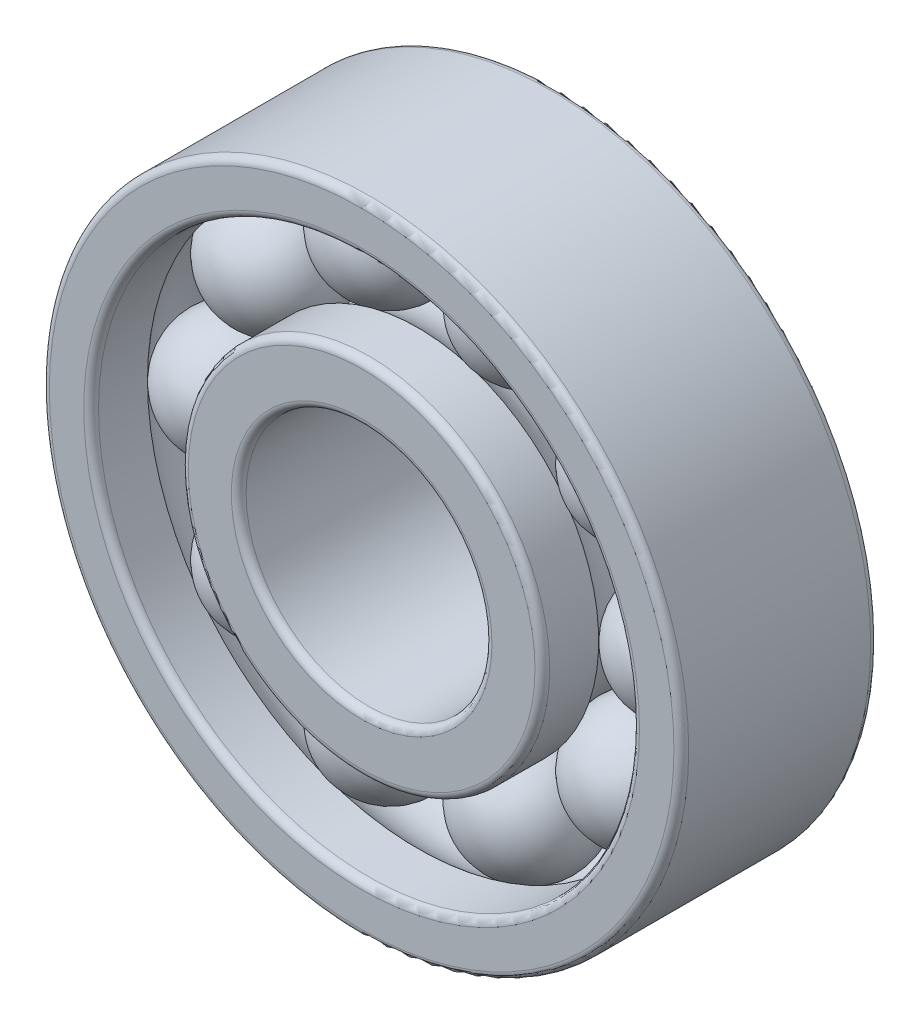
from build123d import *

# Parameters (mm, degrees)
SKETCH1_R             = 13
SKETCH1_R_2           = 11
BOSS_EXTRUDE1_DEPTH   = 8
SKETCH1_R_3           = 7.35
SKETCH1_R_4           = 5
BOSS_EXTRUDE1_2_DEPTH = 8
SKETCH4_R             = 2.5
CIRPATTERN1_COUNT     = 10
FILLET1_R             = 0.3
FILLET2_R             = 0.3


with BuildPart() as part:
    # Sketch1 → Boss-Extrude1 (new body)
    with BuildSketch(Plane.XY):
        Circle(SKETCH1_R)
        Circle(SKETCH1_R_2, mode=Mode.SUBTRACT)
    extrude(amount=BOSS_EXTRUDE1_DEPTH)


with BuildPart() as body_2:
    # Sketch1 → Boss-Extrude1 2 (new body)
    with BuildSketch(Plane.XY):
        Circle(SKETCH1_R_3)
        Circle(SKETCH1_R_4, mode=Mode.SUBTRACT)
    extrude(amount=BOSS_EXTRUDE1_2_DEPTH)


with BuildPart() as cut_sweep1_tool:
    # Cut-Sweep1: sweep along a path in Sketch2
    with BuildLine(Plane.XY.offset(4)) as cut_sweep1_path:
        CenterArc((0, 0), 9.175, 0, 360)
    # Sketch4 → Cut-Sweep1 (sweep)
    with BuildSketch(Plane(origin=(0, 0, 0), x_dir=(1, 0, 0), z_dir=(0, 1, 0))):
        with Locations((-9.175, -4)):
            Circle(SKETCH4_R)
    sweep(path=cut_sweep1_path.line)


with BuildPart() as part_1:
    add(part.part)

    # Cut-Sweep1: cut by cut_sweep1_tool
    add(cut_sweep1_tool.part, mode=Mode.SUBTRACT)

    # Fillet1
    fillet1_edges = [part_1.edges().sort_by_distance(p)[0] for p in [
        (-13, 0, 0),
        (-13, 0, 8),
        (-11, 0, 0),
        (-11, 0, 8),
    ]]
    fillet(fillet1_edges, radius=FILLET1_R)


with BuildPart() as body_2_1:
    add(body_2.part)

    # Cut-Sweep1: cut by cut_sweep1_tool
    add(cut_sweep1_tool.part, mode=Mode.SUBTRACT)

    # Fillet2
    fillet2_edges = [body_2_1.edges().sort_by_distance(p)[0] for p in [
        (-5, 0, 0),
        (-5, 0, 8),
        (-7.35, 0, 0),
        (-7.35, 0, 8),
    ]]
    fillet(fillet2_edges, radius=FILLET2_R)


with BuildPart() as body_3:
    # Sketch5 → Revolve1 (revolve)
    with BuildSketch(Plane(origin=(0, 0, 0), x_dir=(1, 0, 0), z_dir=(0, 1, 0))):
        with BuildLine():
            Line((-9.175, -1.5), (-9.175, -6.5))
            ThreePointArc((-9.175, -6.5), (-11.675, -4), (-9.175, -1.5))
        make_face()
    revolve(axis=Axis((-9.175, 0, 1.5), (0, 0, 1)))


with BuildPart() as cirpattern1_1:
    # CirPattern1: pattern copy
    add(body_3.part.rotate(Axis((0, 0, 0), (0, 0, 1)), 1 * 360 / CIRPATTERN1_COUNT))


with BuildPart() as cirpattern1_2:
    # CirPattern1: pattern copy
    add(body_3.part.rotate(Axis((0, 0, 0), (0, 0, 1)), 2 * 360 / CIRPATTERN1_COUNT))


with BuildPart() as cirpattern1_3:
    # CirPattern1: pattern copy
    add(body_3.part.rotate(Axis((0, 0, 0), (0, 0, 1)), 3 * 360 / CIRPATTERN1_COUNT))


with BuildPart() as cirpattern1_4:
    # CirPattern1: pattern copy
    add(body_3.part.rotate(Axis((0, 0, 0), (0, 0, 1)), 4 * 360 / CIRPATTERN1_COUNT))


with BuildPart() as cirpattern1_5:
    # CirPattern1: pattern copy
    add(body_3.part.rotate(Axis((0, 0, 0), (0, 0, 1)), 5 * 360 / CIRPATTERN1_COUNT))


with BuildPart() as cirpattern1_6:
    # CirPattern1: pattern copy
    add(body_3.part.rotate(Axis((0, 0, 0), (0, 0, 1)), 6 * 360 / CIRPATTERN1_COUNT))


with BuildPart() as cirpattern1_7:
    # CirPattern1: pattern copy
    add(body_3.part.rotate(Axis((0, 0, 0), (0, 0, 1)), 7 * 360 / CIRPATTERN1_COUNT))


with BuildPart() as cirpattern1_8:
    # CirPattern1: pattern copy
    add(body_3.part.rotate(Axis((0, 0, 0), (0, 0, 1)), 8 * 360 / CIRPATTERN1_COUNT))


with BuildPart() as cirpattern1_9:
    # CirPattern1: pattern copy
    add(body_3.part.rotate(Axis((0, 0, 0), (0, 0, 1)), 9 * 360 / CIRPATTERN1_COUNT))


solid = Compound([part_1.part, body_2_1.part, body_3.part, cirpattern1_1.part, cirpattern1_2.part, cirpattern1_3.part, cirpattern1_4.part, cirpattern1_5.part, cirpattern1_6.part, cirpattern1_7.part, cirpattern1_8.part, cirpattern1_9.part])
